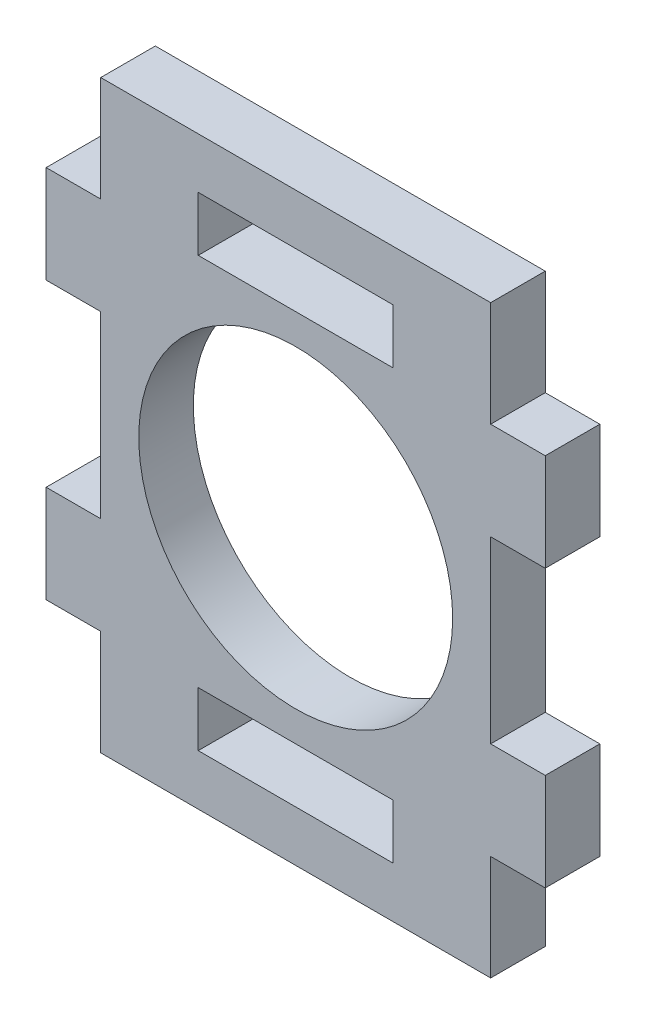
from build123d import *

# Parameters (mm, degrees)
SKETCH_1_R      = 8.05
SKETCH_1_W      = 10
SKETCH_1_H      = 2.8
EXTRUDE_1_DEPTH = 1.4


with BuildPart() as part:
    # Эскиз1 → Бобышка-Вытянуть1 (new, symmetric)
    with BuildSketch(Plane.XY):
        Polygon((-10, 9.6), (-12.8, 9.6), (-12.8, 4.6), (-10, 4.6), (-10, -4.6), (-12.8, -4.6), (-12.8, -9.6), (-10, -9.6), (-10, -15), (10, -15), (10, -9.6), (12.8, -9.6), (12.8, -4.6), (10, -4.6), (10, 4.6), (12.8, 4.6), (12.8, 9.6), (10, 9.6), (10, 15), (-10, 15), align=None)
        Circle(SKETCH_1_R, mode=Mode.SUBTRACT)
        with Locations((0, -11)):
            Rectangle(SKETCH_1_W, SKETCH_1_H, mode=Mode.SUBTRACT)
        with Locations((0, 11)):
            Rectangle(SKETCH_1_W, SKETCH_1_H, mode=Mode.SUBTRACT)
    extrude(amount=EXTRUDE_1_DEPTH, both=True)


solid = part.part
